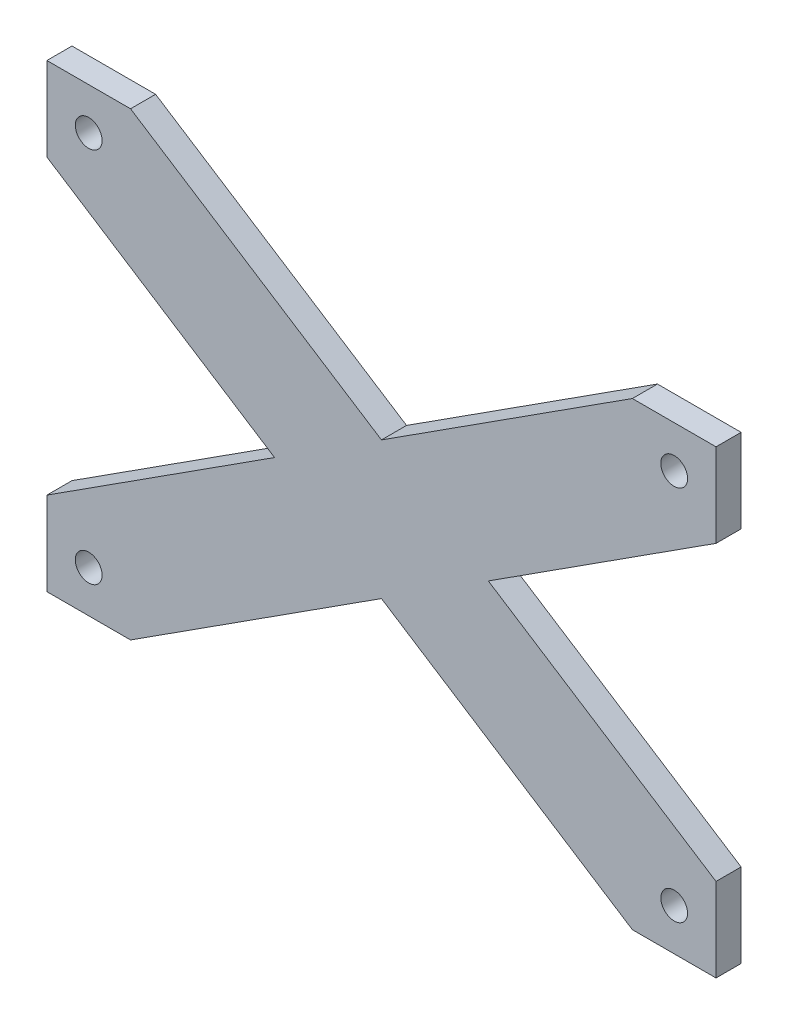
from build123d import *

# Parameters (mm, degrees)
SKETCH_1_W          = 80
SKETCH_1_H          = 55
EXTRUDE_1_DEPTH     = 1.5
SKETCH_3_R          = 1.6
CUT_EXTRUDE_2_DEPTH = 49.633835958
CUT_EXTRUDE_3_DEPTH = 10


with BuildPart() as part:
    # ｽｹｯﾁ1 → ﾎﾞｽ - 押し出し1 (new, symmetric)
    with BuildSketch(Plane.XY):
        Rectangle(SKETCH_1_W, SKETCH_1_H)
    extrude(amount=EXTRUDE_1_DEPTH, both=True)

    # ｽｹｯﾁ3 → ｶｯﾄ - 押し出し2 (cut, through all)
    with BuildSketch(Plane.XY.offset(1.5)):
        with Locations((-35, 22.5)):
            Circle(SKETCH_3_R)
        with Locations(Location((35, 22.5, 0), (0, 0, 180))):
            Circle(SKETCH_3_R)
        with Locations((35, -22.5)):
            Circle(SKETCH_3_R)
        with Locations(Location((-35, -22.5, 0), (0, 0, 180))):
            Circle(SKETCH_3_R)
    extrude(amount=-CUT_EXTRUDE_2_DEPTH, mode=Mode.SUBTRACT)

    # ｽｹｯﾁ4 → ｶｯﾄ - 押し出し3 (cut)
    with BuildSketch(Plane.XY.offset(1.5)):
        Polygon((30, 27.5), (-30, 27.5), (0, 8.214285714), align=None)
        Polygon((-40, -17.5), (-12.777777778, 0), (-40, 17.5), align=None)
        Polygon((30, -27.5), (0, -8.214285714), (-30, -27.5), align=None)
        Polygon((40, 17.5), (12.777777778, 0), (40, -17.5), align=None)
    extrude(amount=-CUT_EXTRUDE_3_DEPTH, mode=Mode.SUBTRACT)


solid = part.part
